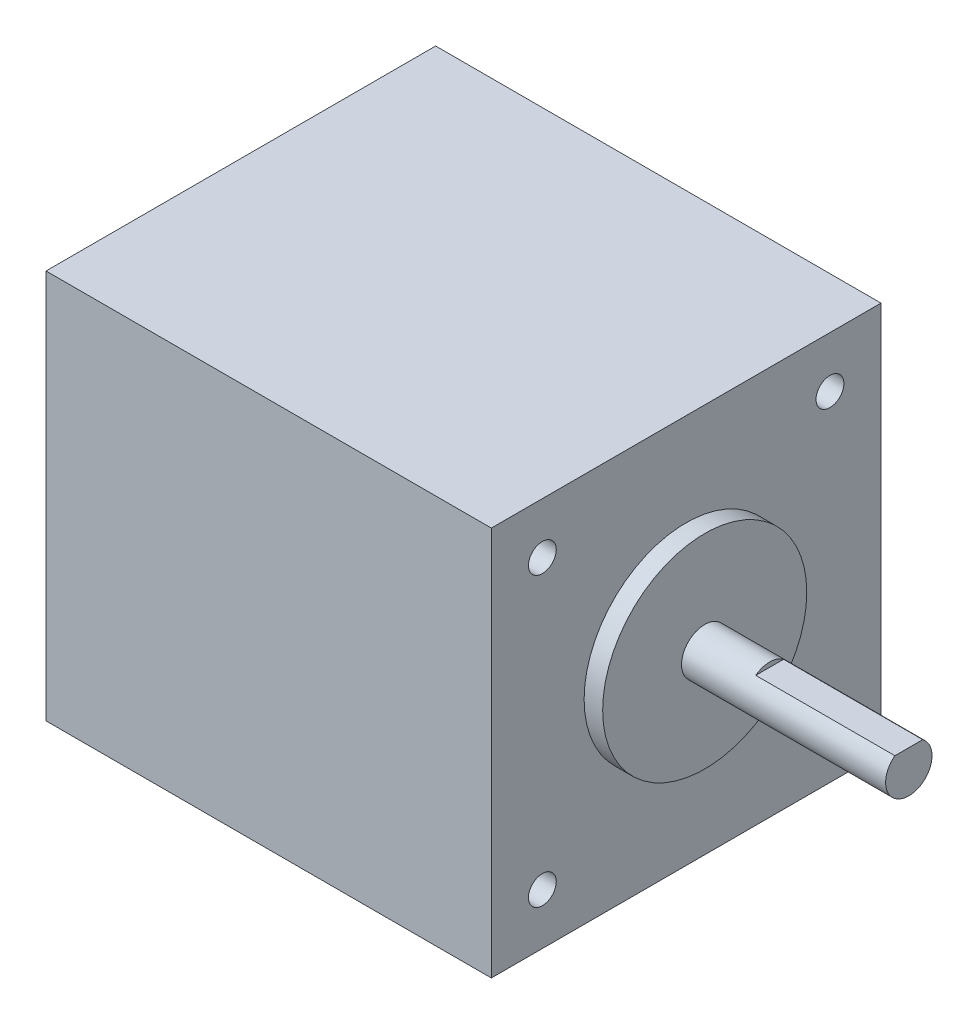
from build123d import *

# Parameters (mm, degrees)
SKETCH1_W           = 42
SKETCH1_H           = 42
BOSS_EXTRUDE1_DEPTH = 48
SKETCH3_R           = 11
BOSS_EXTRUDE2_DEPTH = 2
SKETCH4_R           = 2.5
BOSS_EXTRUDE3_DEPTH = 22
SKETCH5_W           = 15
SKETCH5_H           = 9.626973265
CUT_EXTRUDE1_DEPTH  = 2
CUT_EXTRUDE2_DEPTH  = 4.5


with BuildPart() as part:
    # Sketch1 → Boss-Extrude1 (new body)
    with BuildSketch(Plane(origin=(0, 0, 0), x_dir=(0, 0, -1), z_dir=(1, 0, 0))):
        with Locations((21, 21)):
            Rectangle(SKETCH1_W, SKETCH1_H)
    extrude(amount=BOSS_EXTRUDE1_DEPTH)

    # Sketch3 → Boss-Extrude2 (add)
    with BuildSketch(Plane(origin=(48, 0, 0), x_dir=(0, 0, -1), z_dir=(1, 0, 0))):
        with Locations(Location((21, 21, 0), (0, 0, 180))):
            Circle(SKETCH3_R)
    extrude(amount=BOSS_EXTRUDE2_DEPTH)

    # Sketch4 → Boss-Extrude3 (add)
    with BuildSketch(Plane(origin=(50, 0, 0), x_dir=(0, 0, -1), z_dir=(1, 0, 0))):
        with Locations((21, 21)):
            Circle(SKETCH4_R)
    extrude(amount=BOSS_EXTRUDE3_DEPTH)

    # Sketch5 → Cut-Extrude1 (cut)
    with BuildSketch(Plane(origin=(0, 23, 0), x_dir=(1, 0, 0), z_dir=(0, 1, 0))):
        with Locations((64.5, 20.688698753)):
            Rectangle(SKETCH5_W, SKETCH5_H)
    extrude(amount=CUT_EXTRUDE1_DEPTH, mode=Mode.SUBTRACT)

    # Sketch6 → Cut-Extrude2 (cut)
    with BuildSketch(Plane(origin=(48, 0, 0), x_dir=(0, 0, -1), z_dir=(1, 0, 0))):
        with BuildLine():
            Line((5.5, 35), (5.5, 36.5))
            Line((5.5, 36.5), (7, 36.5))
            ThreePointArc((7, 36.5), (4.439339828, 37.560660172), (5.5, 35))
        make_face()
        with BuildLine():
            Line((7, 36.5), (5.5, 36.5))
            Line((5.5, 36.5), (5.5, 35))
            ThreePointArc((5.5, 35), (6.560660172, 35.439339828), (7, 36.5))
        make_face()
        with BuildLine():
            ThreePointArc((38, 36.5), (36.5, 38), (35, 36.5))
            Line((35, 36.5), (36.5, 36.5))
            Line((36.5, 36.5), (36.5, 35))
            ThreePointArc((36.5, 35), (37.560660172, 35.439339828), (38, 36.5))
        make_face()
        with BuildLine():
            Line((36.5, 36.5), (35, 36.5))
            ThreePointArc((35, 36.5), (35.439339828, 35.439339828), (36.5, 35))
            Line((36.5, 35), (36.5, 36.5))
        make_face()
        with BuildLine():
            ThreePointArc((38, 5.5), (37.560660172, 6.560660172), (36.5, 7))
            Line((36.5, 7), (36.5, 5.5))
            Line((36.5, 5.5), (35, 5.5))
            ThreePointArc((35, 5.5), (36.5, 4), (38, 5.5))
        make_face()
        with BuildLine():
            Line((36.5, 5.5), (36.5, 7))
            ThreePointArc((36.5, 7), (35.439339828, 6.560660172), (35, 5.5))
            Line((35, 5.5), (36.5, 5.5))
        make_face()
        with BuildLine():
            ThreePointArc((7, 5.5), (6.560660172, 6.560660172), (5.5, 7))
            Line((5.5, 7), (5.5, 5.5))
            Line((5.5, 5.5), (7, 5.5))
        make_face()
        with BuildLine():
            Line((5.5, 5.5), (5.5, 7))
            ThreePointArc((5.5, 7), (4.439339828, 4.439339828), (7, 5.5))
            Line((7, 5.5), (5.5, 5.5))
        make_face()
    extrude(amount=-CUT_EXTRUDE2_DEPTH, mode=Mode.SUBTRACT)


solid = part.part
